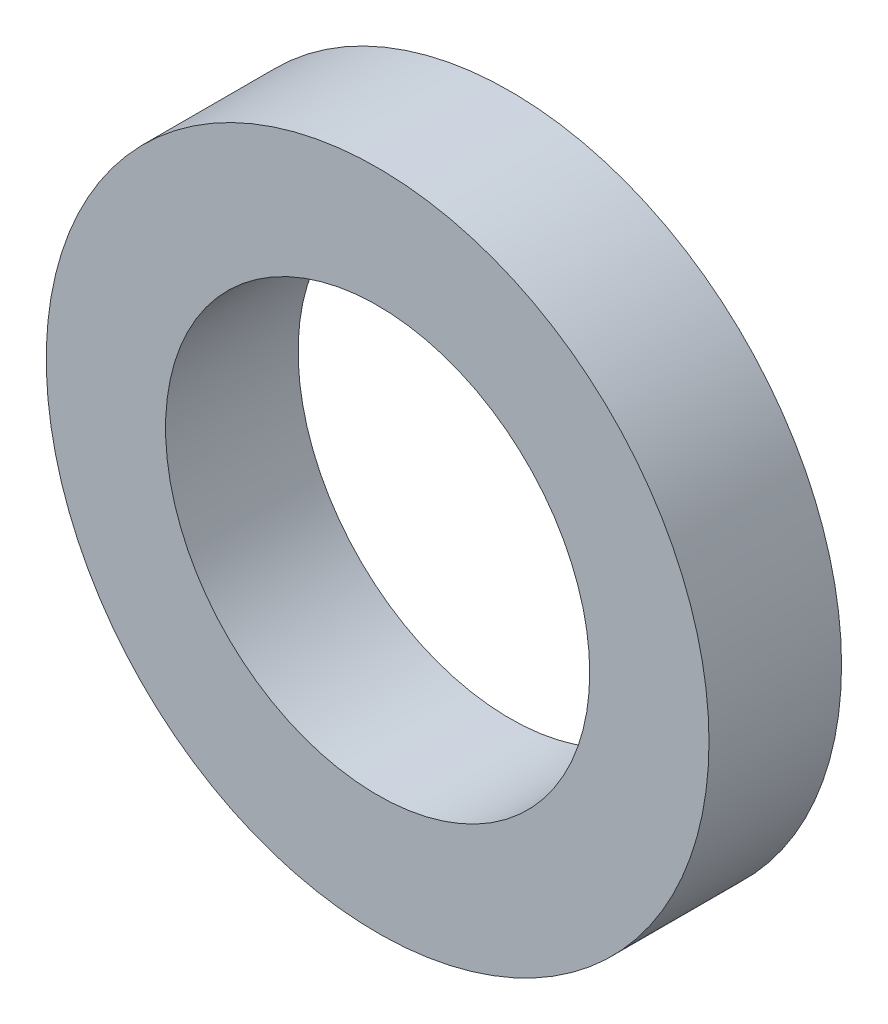
from build123d import *

# Parameters (mm, degrees)
TOP_SKETCH_R            = 2.5
TOP_SKETCH_R_2          = 1.6
EXTRUDE_THICKNESS_DEPTH = 1


with BuildPart() as part:
    # Top Sketch → Extrude Thickness (new body)
    with BuildSketch(Plane.XY):
        Circle(TOP_SKETCH_R)
        Circle(TOP_SKETCH_R_2, mode=Mode.SUBTRACT)
    extrude(amount=EXTRUDE_THICKNESS_DEPTH)


solid = part.part
